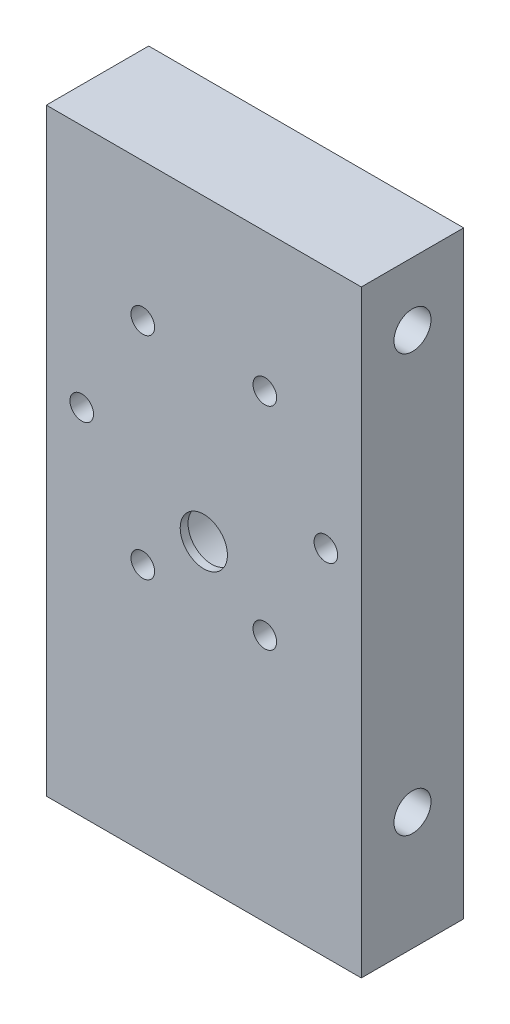
from build123d import *

# Parameters (mm, degrees)
CROQUIS1_W              = 40
CROQUIS1_H              = 76
CROQUIS1_R              = 3
SALIENTE_EXTRUIR1_DEPTH = 13
CROQUIS5_R              = 18.5
CORTAR_EXTRUIR3_DEPTH   = 6
CROQUIS6_R              = 1.5
CORTAR_EXTRUIR4_DEPTH   = 87.168439698
CROQUIS7_R              = 6
CORTAR_EXTRUIR5_DEPTH   = 6
CROQUIS8_R              = 2.35
CORTAR_EXTRUIR6_DEPTH   = 5
CORTAR_EXTRUIR7_START   = -5
CROQUIS9_R              = 2.35
CORTAR_EXTRUIR7_DEPTH   = 5


with BuildPart() as part:
    # Croquis1 → Saliente-Extruir1 (new body)
    with BuildSketch(Plane.XY):
        with Locations((20, 38)):
            Rectangle(CROQUIS1_W, CROQUIS1_H)
        with Locations(Location((20, 38, 0), (0, 0, 180))):
            Circle(CROQUIS1_R, mode=Mode.SUBTRACT)
    extrude(amount=SALIENTE_EXTRUIR1_DEPTH)

    # Croquis5 → Cortar-Extruir3 (cut)
    with BuildSketch(Plane(origin=(0, 0, 0), x_dir=(-1, 0, 0), z_dir=(0, 0, -1))):
        with Locations((-20, 45)):
            Circle(CROQUIS5_R)
    extrude(amount=-CORTAR_EXTRUIR3_DEPTH, mode=Mode.SUBTRACT)

    # Croquis6 → Cortar-Extruir4 (cut, through all)
    with BuildSketch(Plane(origin=(0, 0, 6), x_dir=(-1, 0, 0), z_dir=(0, 0, -1))):
        with Locations((-35.5, 45)):
            Circle(CROQUIS6_R)
        with Locations((-27.75, 58.423393759)):
            Circle(CROQUIS6_R)
        with Locations((-12.25, 58.423393759)):
            Circle(CROQUIS6_R)
        with Locations((-4.5, 45)):
            Circle(CROQUIS6_R)
        with Locations((-12.25, 31.576606241)):
            Circle(CROQUIS6_R)
        with Locations((-27.75, 31.576606241)):
            Circle(CROQUIS6_R)
    extrude(amount=-CORTAR_EXTRUIR4_DEPTH, mode=Mode.SUBTRACT)

    # Croquis7 → Cortar-Extruir5 (cut)
    with BuildSketch(Plane(origin=(0, 0, 6), x_dir=(-1, 0, 0), z_dir=(0, 0, -1))):
        with Locations((-20, 38)):
            Circle(CROQUIS7_R)
    extrude(amount=-CORTAR_EXTRUIR5_DEPTH, mode=Mode.SUBTRACT)

    # Croquis8 → Cortar-Extruir6 (cut)
    with BuildSketch(Plane(origin=(40, 0, 0), x_dir=(0, 0, -1), z_dir=(1, 0, 0))):
        with Locations((-6.5, 68)):
            Circle(CROQUIS8_R)
        with Locations((-6.5, 15)):
            Circle(CROQUIS8_R)
    extrude(amount=-CORTAR_EXTRUIR6_DEPTH, mode=Mode.SUBTRACT)

    # Croquis9 → Cortar-Extruir7 (cut)
    with BuildSketch(Plane.ZY.offset(CORTAR_EXTRUIR7_START)):
        with Locations(Location((6.5, 68, 0), (0, 0, 180))):
            Circle(CROQUIS9_R)
        with Locations(Location((6.5, 15, 0), (0, 0, 180))):
            Circle(CROQUIS9_R)
    extrude(amount=CORTAR_EXTRUIR7_DEPTH, mode=Mode.SUBTRACT)


solid = part.part
